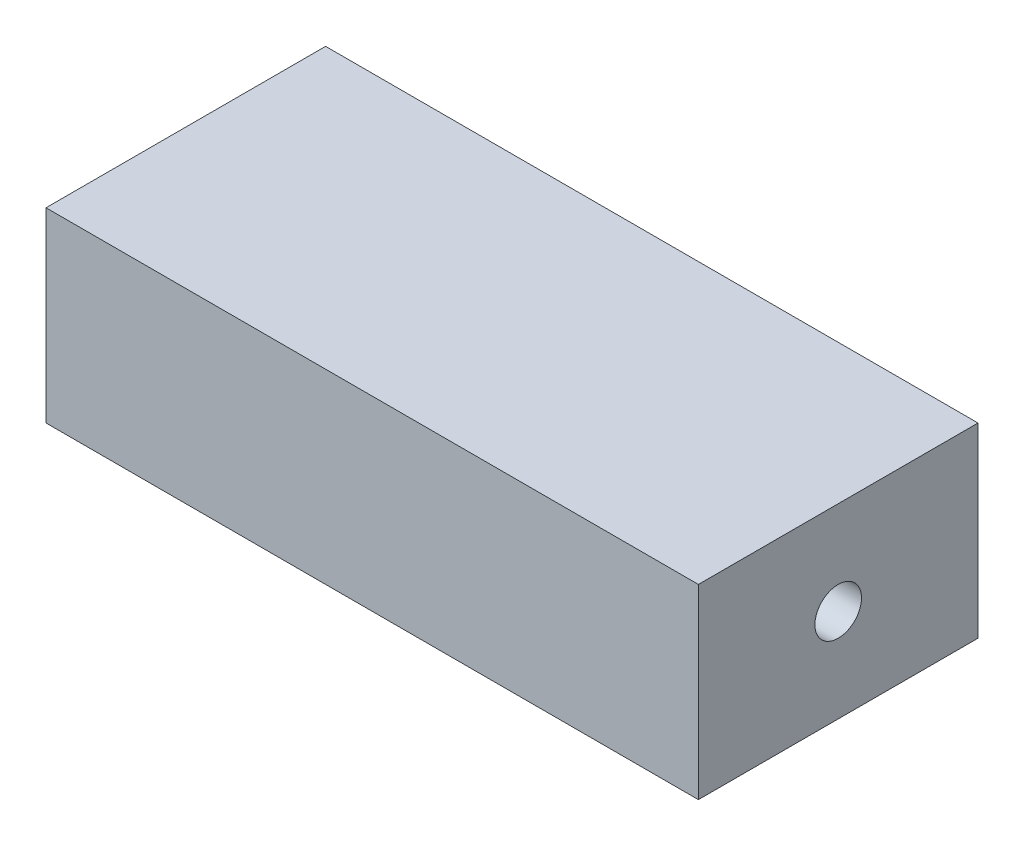
from build123d import *

# Parameters (mm, degrees)
SKETCH1_W           = 88.9
SKETCH1_H           = 38.1
BOSS_EXTRUDE1_DEPTH = 25.4
SKETCH2_R           = 3.175
CUT_EXTRUDE1_DEPTH  = 100.9999


with BuildPart() as part:
    # Sketch1 → Boss-Extrude1 (new body)
    with BuildSketch(Plane(origin=(0, 0, 0), x_dir=(1, 0, 0), z_dir=(0, 1, 0))):
        with Locations((44.45, 19.05)):
            Rectangle(SKETCH1_W, SKETCH1_H)
    extrude(amount=BOSS_EXTRUDE1_DEPTH)

    # Sketch2 → Cut-Extrude1 (cut, through all)
    with BuildSketch(Plane(origin=(88.9, 0, 0), x_dir=(0, 0, -1), z_dir=(1, 0, 0))):
        with Locations((19.05, 12.7)):
            Circle(SKETCH2_R)
    extrude(amount=-CUT_EXTRUDE1_DEPTH, mode=Mode.SUBTRACT)


solid = part.part
